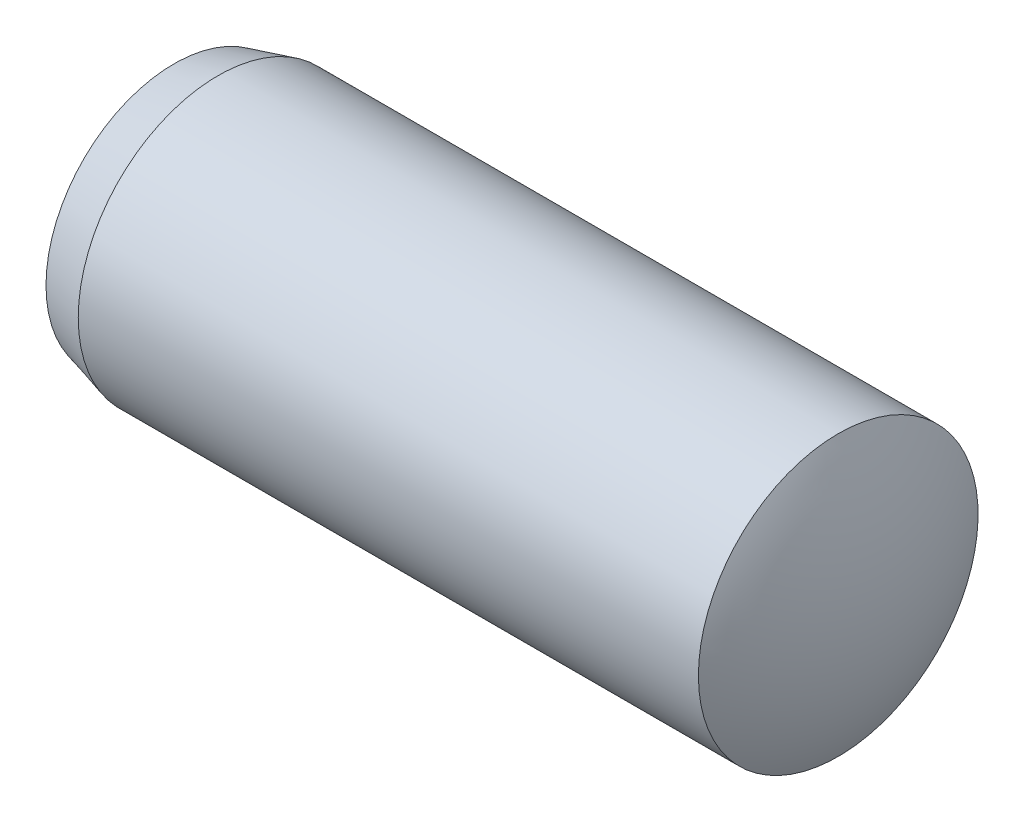
from build123d import *


with BuildPart() as part:
    # Эскиз1 → Повернуть1 (revolve)
    with BuildSketch(Plane.XY, mode=Mode.PRIVATE) as revolve_1_sk:
        with BuildLine():
            Line((-0.5, 2), (-9.37, 2))
            Line((-9.37, 2), (-10, 1.831192009))
            Line((-10, 1.831192009), (-10, 0))
            Line((-10, 0), (0, 0))
            ThreePointArc((0, 0), (-0.126894374, 1.030776406), (-0.5, 2))
        make_face()
    revolve(revolve_1_sk.sketch.rotate(Axis((-11.022517244, 0, 0), (1, 0, 0)), 90), axis=Axis((-11.022517244, 0, 0), (1, 0, 0)))


solid = part.part
